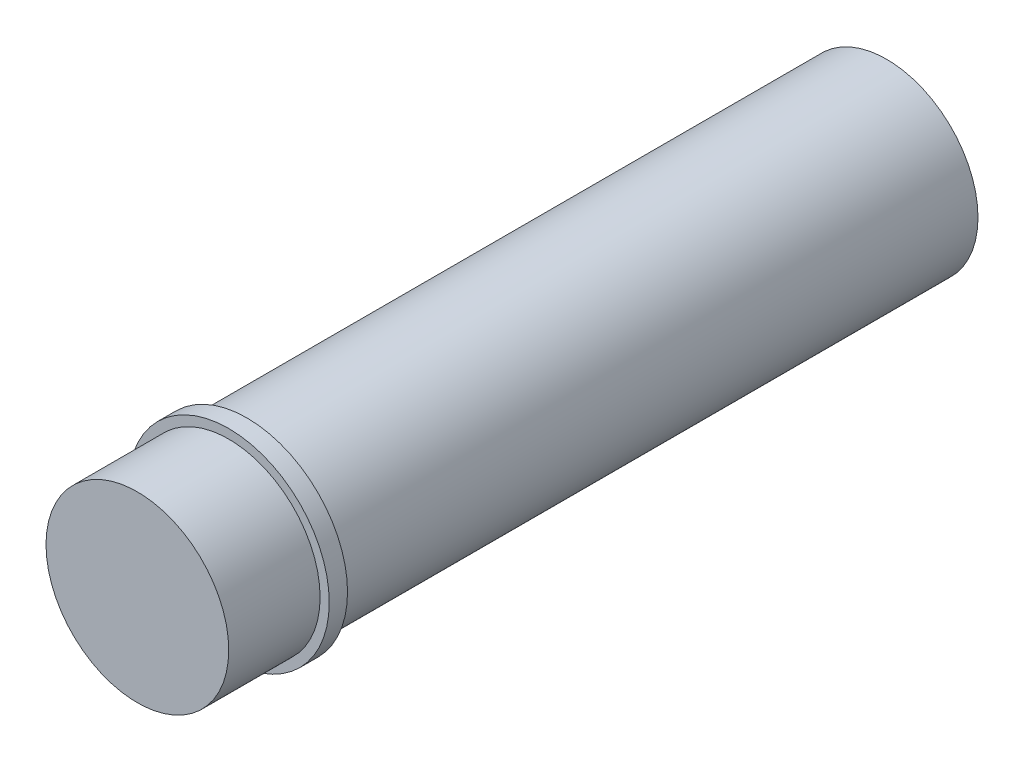
from build123d import *

# Parameters (mm, degrees)
SKETCH1_R           = 12.7
BOSS_EXTRUDE1_DEPTH = 88.9
SKETCH2_R           = 13.97
BOSS_EXTRUDE2_DEPTH = 2.54
SKETCH3_R           = 12.7
BOSS_EXTRUDE3_DEPTH = 12.7


with BuildPart() as part:
    # Sketch1 → Boss-Extrude1 (new body)
    with BuildSketch(Plane.XY):
        Circle(SKETCH1_R)
    extrude(amount=BOSS_EXTRUDE1_DEPTH)

    # Sketch2 → Boss-Extrude2 (add)
    with BuildSketch(Plane.XY.offset(88.9)):
        Circle(SKETCH2_R)
    extrude(amount=BOSS_EXTRUDE2_DEPTH)

    # Sketch3 → Boss-Extrude3 (add)
    with BuildSketch(Plane.XY.offset(91.44)):
        Circle(SKETCH3_R)
    extrude(amount=BOSS_EXTRUDE3_DEPTH)


solid = part.part
